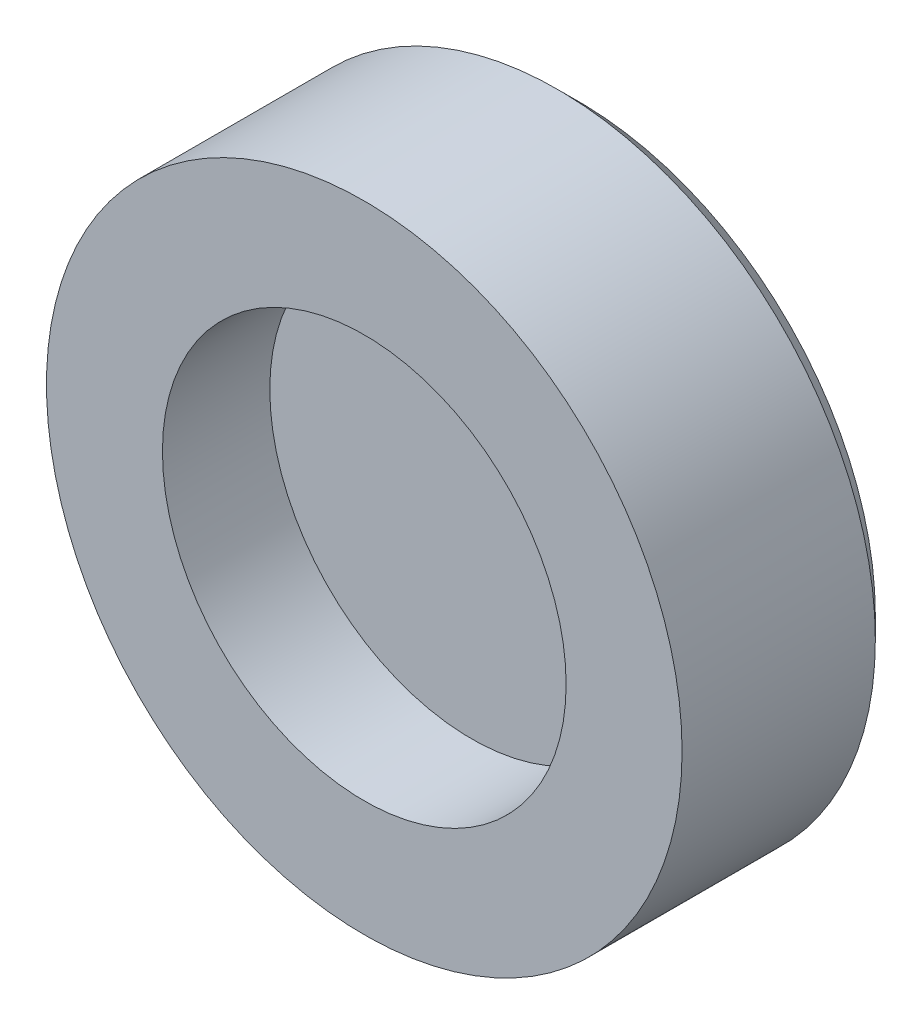
from build123d import *

# Parameters (mm, degrees)
CHAMFER1_SIZE = 0.5


with BuildPart() as part:
    # Sketch1 → Revolve1 (revolve)
    with BuildSketch(Plane(origin=(0, 0, 0), x_dir=(1, 0, 0), z_dir=(0, 1, 0)), mode=Mode.PRIVATE) as revolve1_sk:
        Polygon((-7.4, -5), (-4.7, -5), (-4.7, -2.5), (0, -2.5), (0, 0), (-7.4, 0), align=None)
    revolve(revolve1_sk.sketch.rotate(Axis((0, 0, 16.819807692), (0, 0, -1)), 180), axis=Axis((0, 0, 16.819807692), (0, 0, -1)))

    # Chamfer1
    chamfer1_edges = [part.edges().sort_by_distance(p)[0] for p in [
        (-7.4, 0, 0),
    ]]
    chamfer(chamfer1_edges, length=CHAMFER1_SIZE)


solid = part.part
